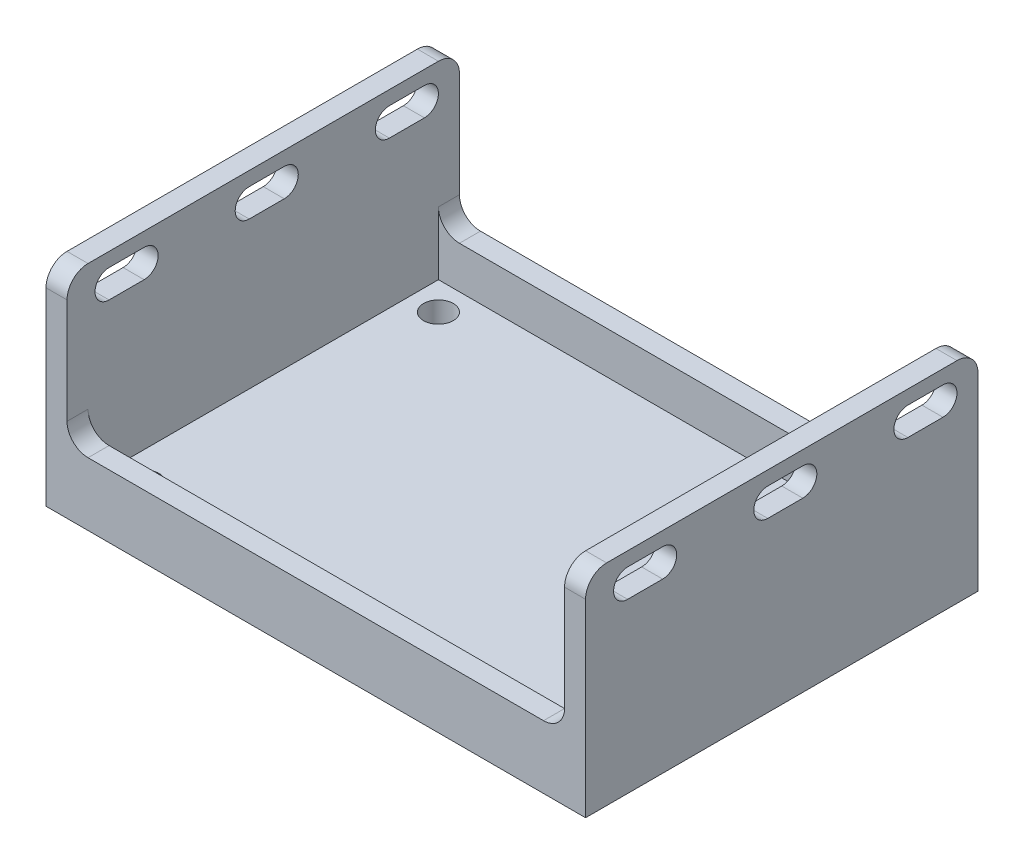
from build123d import *

# Parameters (mm, degrees)
SKETCH1_W           = 71
SKETCH1_H           = 50
SKETCH1_R           = 2.125
BOSS_EXTRUDE1_DEPTH = 3
SKETCH2_W           = 77
SKETCH2_H           = 56
SKETCH2_W_2         = 71
SKETCH2_H_2         = 50
BOSS_EXTRUDE2_DEPTH = 30
SKETCH3_W           = 71
SKETCH3_H           = 30
CUT_EXTRUDE1_DEPTH  = 75.284924446
CUT_EXTRUDE2_DEPTH  = 88.252507127
FILLET1_R           = 3


with BuildPart() as part:
    # Sketch1 → Boss-Extrude1 (new body)
    with BuildSketch(Plane(origin=(0, 0, 0), x_dir=(1, 0, 0), z_dir=(0, 1, 0))):
        Rectangle(SKETCH1_W, SKETCH1_H)
        with Locations(Location((-31.5, 21, 0), (0, 0, 270))):
            Circle(SKETCH1_R, mode=Mode.SUBTRACT)
        with Locations(Location((31.5, 21, 0), (0, 0, 270))):
            Circle(SKETCH1_R, mode=Mode.SUBTRACT)
        with Locations(Location((31.5, -21, 0), (0, 0, 270))):
            Circle(SKETCH1_R, mode=Mode.SUBTRACT)
        with Locations(Location((-31.5, -21, 0), (0, 0, 270))):
            Circle(SKETCH1_R, mode=Mode.SUBTRACT)
    extrude(amount=BOSS_EXTRUDE1_DEPTH)

    # Sketch2 → Boss-Extrude2 (add)
    with BuildSketch(Plane(origin=(0, 0, 0), x_dir=(1, 0, 0), z_dir=(0, 1, 0))):
        Rectangle(SKETCH2_W, SKETCH2_H)
        Rectangle(SKETCH2_W_2, SKETCH2_H_2, mode=Mode.SUBTRACT)
    extrude(amount=BOSS_EXTRUDE2_DEPTH)

    # Sketch3 → Cut-Extrude1 (cut, through all)
    with BuildSketch(Plane(origin=(0, 0, -28), x_dir=(-1, 0, 0), z_dir=(0, 0, -1))):
        with Locations((0, 24)):
            Rectangle(SKETCH3_W, SKETCH3_H)
    extrude(amount=-CUT_EXTRUDE1_DEPTH, mode=Mode.SUBTRACT)

    # Sketch4 → Cut-Extrude2 (cut, through all)
    with BuildSketch(Plane.ZY.offset(38.5)):
        with BuildLine():
            Line((-18, 24), (-23, 24))
            ThreePointArc((-23, 24), (-25, 26), (-23, 28))
            Line((-23, 28), (-18, 28))
            ThreePointArc((-18, 28), (-16, 26), (-18, 24))
        make_face()
        with BuildLine():
            Line((2, 28), (-3, 28))
            ThreePointArc((-3, 28), (-5, 26), (-3, 24))
            Line((-3, 24), (2, 24))
            ThreePointArc((2, 24), (4, 26), (2, 28))
        make_face()
        with BuildLine():
            Line((22, 28), (17, 28))
            ThreePointArc((17, 28), (15, 26), (17, 24))
            Line((17, 24), (22, 24))
            ThreePointArc((22, 24), (24, 26), (22, 28))
        make_face()
    extrude(amount=-CUT_EXTRUDE2_DEPTH, mode=Mode.SUBTRACT)

    # Fillet1
    fillet1_edges = [part.edges().sort_by_distance(p)[0] for p in [
        (37, 30, -28),
        (-37, 30, 28),
        (37, 30, 28),
        (-37, 30, -28),
        (35.5, 9, -26.5),
        (-35.5, 9, -26.5),
        (35.5, 9, 26.5),
        (-35.5, 9, 26.5),
    ]]
    fillet(fillet1_edges, radius=FILLET1_R)


solid = part.part
